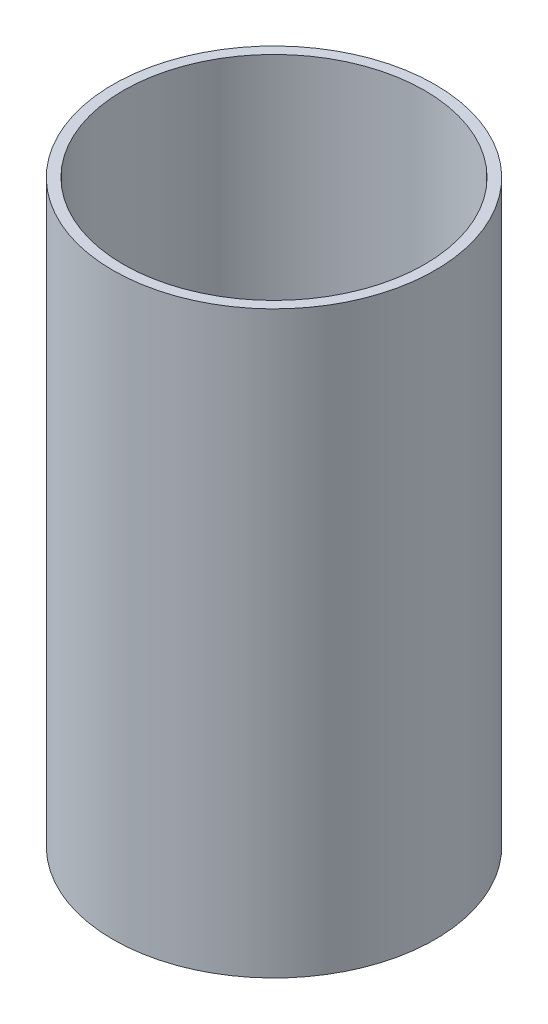
from build123d import *


with BuildPart() as part:
    # Sketch1 → Revolve1 (revolve)
    with BuildSketch(Plane.XY, mode=Mode.PRIVATE) as revolve1_sk:
        Polygon((0, 0), (49.403, 0), (49.403, 177.8), (46.228, 177.8), (46.228, 3.175), (0, 3.175), align=None)
    revolve(revolve1_sk.sketch.rotate(Axis((0, -8.89, 0), (0, 1, 0)), 90), axis=Axis((0, -8.89, 0), (0, 1, 0)))


solid = part.part
